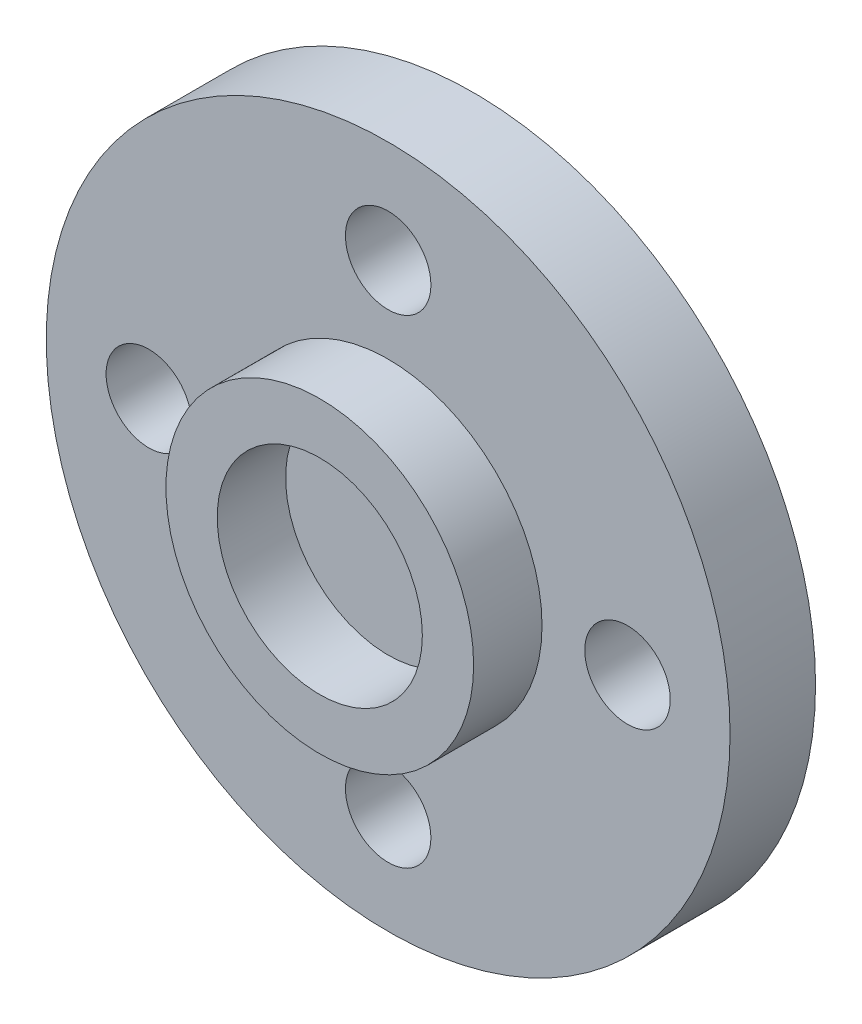
from build123d import *

# Parameters (mm, degrees)
SKETCH_1_R          = 10
EXTRUDE_1_DEPTH     = 2.5
SKETCH_2_R          = 4.5
SKETCH_2_R_2        = 3
EXTRUDE_2_DEPTH     = 2
SKETCH_3_R          = 1.25
CUT_EXTRUDE_1_DEPTH = 15.361406616


with BuildPart() as part:
    # 草图1 → 凸台-拉伸1 (new body)
    with BuildSketch(Plane.XY):
        Circle(SKETCH_1_R)
    extrude(amount=EXTRUDE_1_DEPTH)

    # 草图2 → 凸台-拉伸2 (add)
    with BuildSketch(Plane.XY.offset(2.5)):
        Circle(SKETCH_2_R)
        Circle(SKETCH_2_R_2, mode=Mode.SUBTRACT)
    extrude(amount=EXTRUDE_2_DEPTH)

    # 草图3 → 切除-拉伸1 (cut, through all)
    with BuildSketch(Plane.XY.offset(2.5)):
        with Locations((0, 7)):
            Circle(SKETCH_3_R)
        with Locations((7, 0)):
            Circle(SKETCH_3_R)
        with Locations((0, -7)):
            Circle(SKETCH_3_R)
        with Locations((-7, 0)):
            Circle(SKETCH_3_R)
    extrude(amount=-CUT_EXTRUDE_1_DEPTH, mode=Mode.SUBTRACT)


solid = part.part
